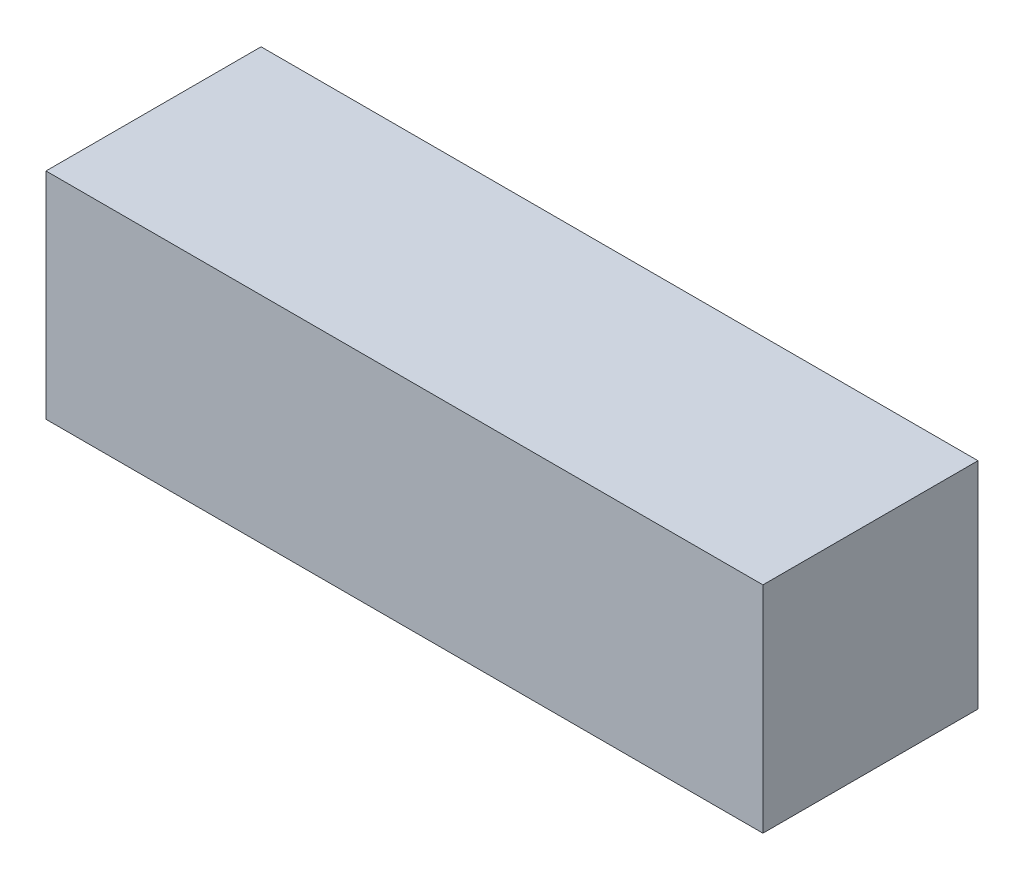
from build123d import *

# Parameters (mm, degrees)
SKETCH_2_W      = 6
SKETCH_2_H      = 6
EXTRUDE_1_DEPTH = 20


with BuildPart() as part:
    # 草图2 → 凸台-拉伸1 (new body)
    with BuildSketch(Plane(origin=(0, 0, 0), x_dir=(0, 0, -1), z_dir=(1, 0, 0))):
        Rectangle(SKETCH_2_W, SKETCH_2_H)
    extrude(amount=EXTRUDE_1_DEPTH)


solid = part.part
